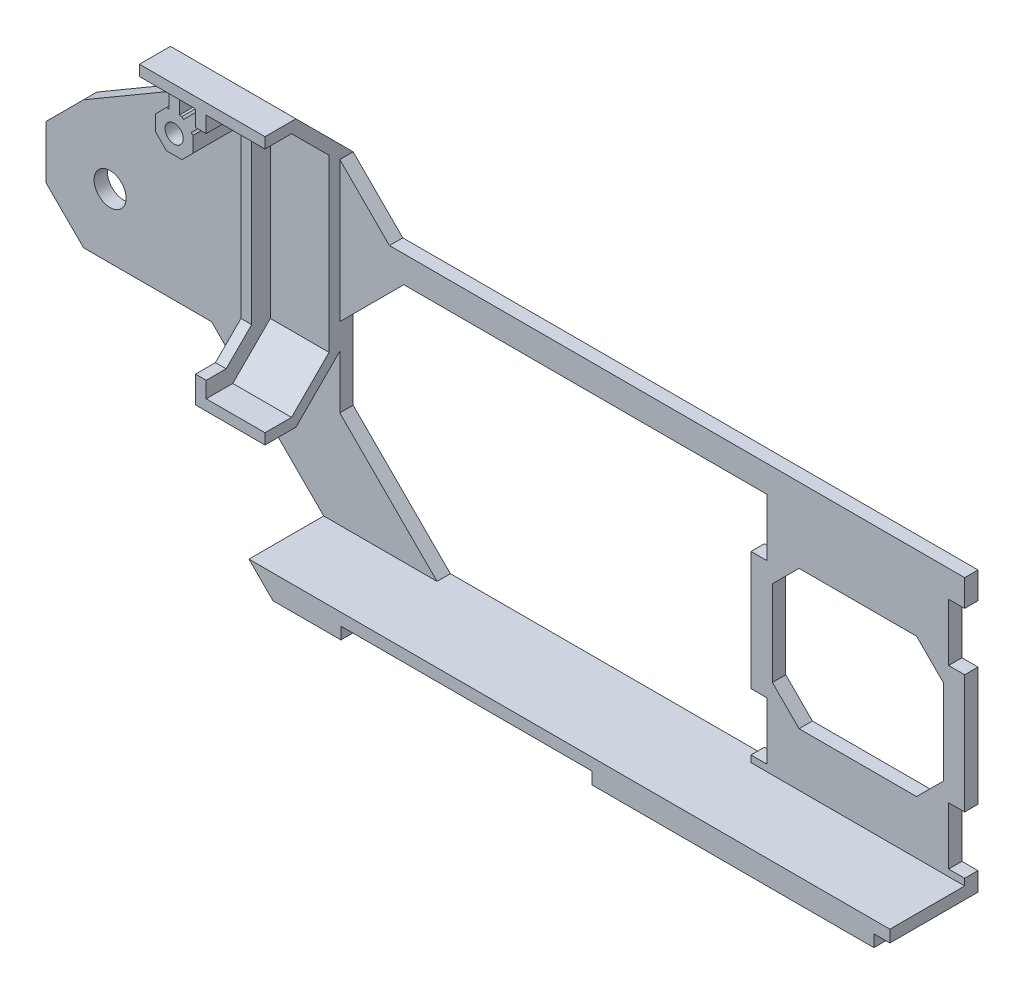
from build123d import *

# Parameters (mm, degrees)
SKETCH4_R            = 3
MAIN_WALL_DEPTH      = 2.5
BASE_DEPTH           = 14
BOSS_EXTRUDE8_DEPTH  = 2
BOSS_EXTRUDE9_DEPTH  = 11
BOSS_EXTRUDE15_DEPTH = 12.5
BOSS_EXTRUDE13_REACH = 169.888
SKETCH19_R           = 1.7
CUT_EXTRUDE1_DEPTH   = 7


with BuildPart() as part:
    # Sketch4 → Main Wall (new body)
    with BuildSketch(Plane.XY):
        Polygon((-97, 59.3), (-113.5, 59.3), (-120.5, 59.3), (-144.970562748, 45), (-152, 37.970562748), (-152, 28.029437252), (-144.970562748, 21), (-135.029437252, 21), (-121, 21), (-95.5, -4.5), (-82.786796564, -4.5), (-82.786796564, -2.25), (-35.786796564, -2.25), (-35.786796564, -4.5), (17, -4.5), (17, -2.25), (20, -2.25), (20, 1.25), (17, 1.25), (17, 12), (20, 12), (20, 34.25), (17, 34.25), (17, 45), (20, 45), (20, 50), (-87.7, 50), align=None)
        with Locations((-140, 33)):
            Circle(SKETCH4_R, mode=Mode.SUBTRACT)
        Polygon((-20, 0), (-20, 1.25), (-17, 1.25), (-17, 12), (-20, 12), (-20, 34.25), (-17, 34.25), (-17, 45), (-85, 45), (-97, 33), (-97, 18.213203436), (-78.786796564, 0), align=None, mode=Mode.SUBTRACT)
        Polygon((11, 36), (-11, 36), (-16, 31), (-16, 15), (-11, 10), (11, 10), (16, 15), (16, 31), align=None, mode=Mode.SUBTRACT)
    extrude(amount=MAIN_WALL_DEPTH)

    # Sketch5 → Base (add)
    with BuildSketch(Plane.XY.offset(2.5)):
        Polygon((20, 0), (20, -2.25), (17, -2.25), (17, -4.5), (-35.786796564, -4.5), (-35.786796564, -2.25), (-82.786796564, -2.25), (-82.786796564, -4.5), (-95.5, -4.5), (-100, 0), align=None)
    extrude(amount=BASE_DEPTH)

    # Sketch15 → Boss-Extrude8 (add)
    with BuildSketch(Plane(origin=(-108, 0, 0), x_dir=(0, 0, -1), z_dir=(1, 0, 0))):
        Polygon((0, 30.701010127), (0, 59.298989873), (-10.701010127, 70), (-16.5, 70), (-16.5, 68), (-16.5, 65), (-12.772077939, 65), (-8, 60.227922061), (-8, 29.772077939), (-12.772077939, 25), (-16.5, 25), (-16.5, 20), (-10.701010127, 20), align=None)
    extrude(amount=-BOSS_EXTRUDE8_DEPTH)

    # Sketch16 → Boss-Extrude9 (add)
    with BuildSketch(Plane(origin=(-108, 0, 0), x_dir=(0, 0, -1), z_dir=(1, 0, 0))):
        Polygon((-16.5, 68), (-11.529437252, 68), (-4.5, 60.970562748), (-4.5, 29.029437252), (-11.529437252, 22), (-16.5, 22), (-16.5, 20), (-10.701010127, 20), (0, 30.701010127), (0, 59.298989873), (-10.701010127, 70), (-16.5, 70), align=None)
    extrude(amount=BOSS_EXTRUDE9_DEPTH)

    # Sketch17 → Boss-Extrude15 (add)
    with BuildSketch(Plane(origin=(-108, 0, 0), x_dir=(0, 0, -1), z_dir=(1, 0, 0))):
        Polygon((0, 59.298989873), (-10.701010127, 70), (-16.5, 70), (-16.5, 68), (-11.529437252, 68), (-2.5, 58.970562748), (-2.5, 50), (0, 50), align=None)
    extrude(amount=-BOSS_EXTRUDE15_DEPTH)

    # Sketch18 → Boss-Extrude13 (add, up to next)
    with BuildSketch(Plane.XY.offset(13.5), mode=Mode.PRIVATE) as boss_extrude13_sk1:
        Polygon((-115.550252532, 62.5), (-116, 62.5), (-116, 69.5), (-118, 69.5), (-118, 62.5), (-118.449747468, 62.5), (-120.5, 60.449747468), (-120.5, 57.550252532), (-118.449747468, 55.5), (-115.550252532, 55.5), (-113.5, 57.550252532), (-113.5, 60.449747468), (-113.818019485, 60.767766953), (-108.161165235, 66.424621202), (-109.575378798, 67.838834765), (-115.232233047, 62.181980515), align=None)
    boss_extrude13_tool1 = extrude(boss_extrude13_sk1.sketch, amount=-BOSS_EXTRUDE13_REACH, mode=Mode.PRIVATE) - part.part
    add(boss_extrude13_tool1.solids().sort_by_distance((-115.797998, 61.590243, 13.5))[0])

    # Sketch19 → Cut-Extrude1 (cut)
    with BuildSketch(Plane.XY.offset(13.5)):
        with Locations((-117, 59)):
            Circle(SKETCH19_R)
    extrude(amount=-CUT_EXTRUDE1_DEPTH, mode=Mode.SUBTRACT)


solid = part.part
